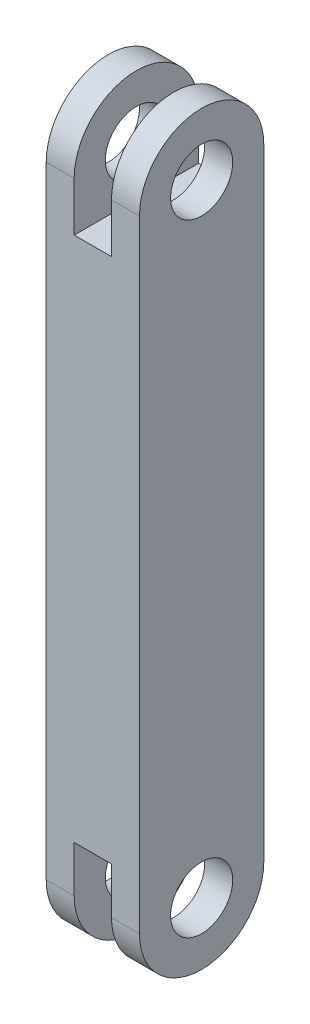
from build123d import *

# Parameters (mm, degrees)
BOSS_EXTRUDE1_DEPTH     = 9.525
CUT_EXTRUDE4_DEPTH      = 143.309436177
CUT_EXTRUDE4_DEPTH_BACK = 143.309436177
SKETCH3_W               = 7.62
SKETCH3_H               = 30.142095215
CUT_EXTRUDE6_DEPTH      = 142.563704741
CUT_EXTRUDE6_DEPTH_BACK = 142.563704741
SKETCH5_R               = 6.35


with BuildPart() as part:
    # Sketch1 → Boss-Extrude1 (new, symmetric)
    with BuildSketch(Plane.YZ):
        with BuildLine():
            Line((0, 12.7), (127, 12.7))
            ThreePointArc((127, 12.7), (139.7, 0), (127, -12.7))
            Line((127, -12.7), (0, -12.7))
            ThreePointArc((0, -12.7), (-12.7, 0), (0, 12.7))
        make_face()
    extrude(amount=BOSS_EXTRUDE1_DEPTH, both=True)

    # Sketch3 → Cut-Extrude4 (cut, two sides: drawn at the far end of the back side and taken through both)
    with BuildSketch(Plane.XY.offset(12.7).offset(-CUT_EXTRUDE4_DEPTH_BACK)):
        with Locations((0, 132.016308081)):
            Rectangle(SKETCH3_W, SKETCH3_H)
        with Locations((0, -5.601173979)):
            Rectangle(SKETCH3_W, SKETCH3_H)
    extrude(amount=CUT_EXTRUDE4_DEPTH + CUT_EXTRUDE4_DEPTH_BACK, mode=Mode.SUBTRACT)

    # Sketch5 → Cut-Extrude6 (cut, two sides: drawn at the far end of the back side and taken through both)
    with BuildSketch(Plane.YZ.offset(9.525).offset(-CUT_EXTRUDE6_DEPTH_BACK)):
        with Locations(Location((0, 0, 0), (0, 0, 270))):
            Circle(SKETCH5_R)
        with Locations(Location((127, 0, 0), (0, 0, 270))):
            Circle(SKETCH5_R)
    extrude(amount=CUT_EXTRUDE6_DEPTH + CUT_EXTRUDE6_DEPTH_BACK, mode=Mode.SUBTRACT)


solid = part.part
